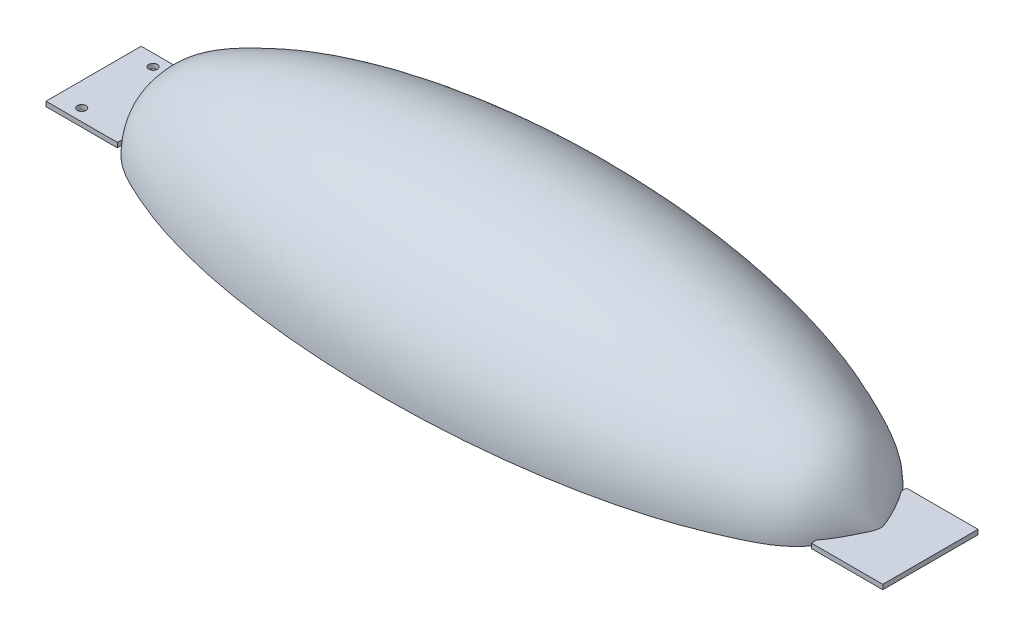
from build123d import *

# Parameters (mm, degrees)
SKETCH2_W           = 411.5
SKETCH2_H           = 160
CUT_EXTRUDE1_DEPTH  = 80
SKETCH3_W           = 30
SKETCH3_H           = 40
BOSS_EXTRUDE1_DEPTH = 2
SKETCH4_R           = 1.8
CUT_EXTRUDE2_DEPTH  = 3


with BuildPart() as part:
    # Sketch1 → Revolve1 (revolve)
    with BuildSketch(Plane.XY):
        with BuildLine():
            Line((-311.5, 0), (0, 0))
            add(Edge.make_bspline(
                [(0, 0), (-4.249188638, 8.939946202), (-11.173928963, 23.509034853), (-30.810162159, 33.046974687), (-46.441549878, 39.47690674), (-62.177539308, 44.133929886), (-77.788581107, 47.757077421), (-93.396855786, 50.518103448), (-108.989945516, 52.568272273), (-124.579052843, 53.984477346), (-140.165074085, 54.816865647), (-155.75, 55.091508563), (-171.334925915, 54.816865647), (-186.920947157, 53.984477346), (-202.510054484, 52.568272273), (-218.103144214, 50.518103448), (-233.711418893, 47.757077421), (-249.322460692, 44.133929886), (-265.058450122, 39.47690674), (-280.689837841, 33.046974687), (-300.326071037, 23.509034853), (-307.250811362, 8.939946202), (-311.5, 0)],
                knots=[0, 0, 0, 0, 0.082153923, 0.133883109, 0.182138728, 0.228907224, 0.274864285, 0.320326742, 0.36547253, 0.410415353, 0.455236349, 0.5, 0.544763651, 0.589584647, 0.63452747, 0.679673258, 0.725135715, 0.771092776, 0.817861272, 0.866116891, 0.917846077, 1, 1, 1, 1], degree=3))
        make_face()
    revolve(axis=Axis((10, 0, 0), (-1, 0, 0)))

    # Sketch2 → Cut-Extrude1 (cut)
    with BuildSketch(Plane(origin=(0, 0, 0), x_dir=(1, 0, 0), z_dir=(0, 1, 0))):
        with Locations((-155.75, 0)):
            Rectangle(SKETCH2_W, SKETCH2_H)
    extrude(amount=-CUT_EXTRUDE1_DEPTH, mode=Mode.SUBTRACT)

    # Sketch3 → Boss-Extrude1 (add)
    with BuildSketch(Plane(origin=(0, 0, 0), x_dir=(1, 0, 0), z_dir=(0, 1, 0))):
        with Locations((-316.5, 0)):
            Rectangle(SKETCH3_W, SKETCH3_H)
        with Locations((5, 0)):
            Rectangle(SKETCH3_W, SKETCH3_H)
    extrude(amount=BOSS_EXTRUDE1_DEPTH)

    # Sketch4 → Cut-Extrude2 (cut)
    with BuildSketch(Plane(origin=(0, 0, 0), x_dir=(1, 0, 0), z_dir=(0, 1, 0))):
        with Locations(Location((-321.5, -15, 0), (0, 0, 90))):
            Circle(SKETCH4_R)
        with Locations(Location((-321.5, 15, 0), (0, 0, 90))):
            Circle(SKETCH4_R)
    extrude(amount=CUT_EXTRUDE2_DEPTH, mode=Mode.SUBTRACT)


solid = part.part
